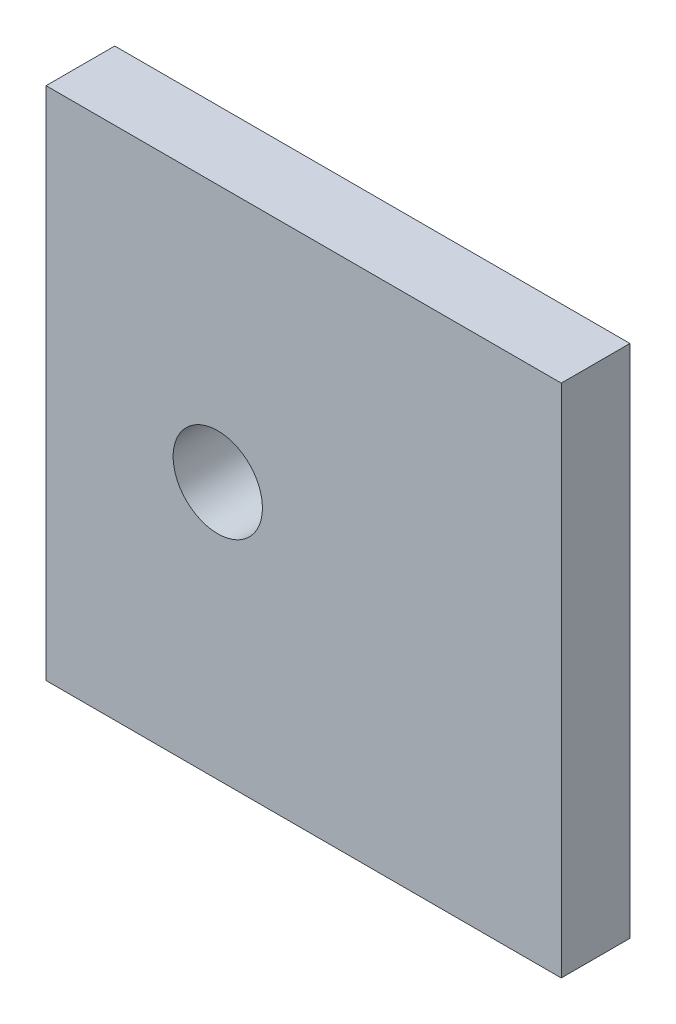
from build123d import *

# Parameters (mm, degrees)
SKETCH1_W          = 150
SKETCH1_H          = 150
EXTRUDE1_DEPTH     = 20
SKETCH2_R          = 13
CUT_EXTRUDE1_DEPTH = 214.072757527


with BuildPart() as part:
    # Sketch1 → Extrude1 (new body)
    with BuildSketch(Plane.XY):
        with Locations((75, 75)):
            Rectangle(SKETCH1_W, SKETCH1_H)
    extrude(amount=EXTRUDE1_DEPTH)

    # Sketch2 → Cut-Extrude1 (cut, through all)
    with BuildSketch(Plane.XY.offset(20)):
        with Locations((50, 75)):
            Circle(SKETCH2_R)
    extrude(amount=-CUT_EXTRUDE1_DEPTH, mode=Mode.SUBTRACT)


solid = part.part
